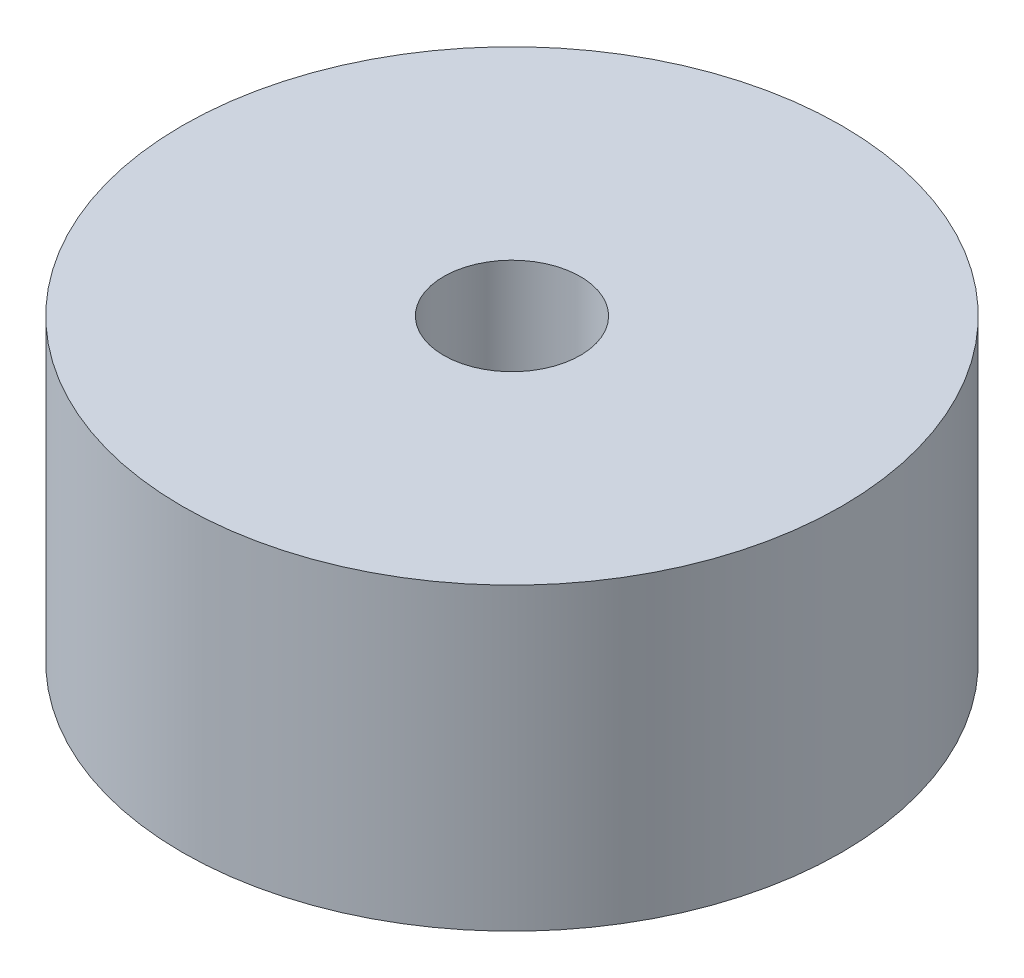
from build123d import *

# Parameters (mm, degrees)
SKETCH1_R           = 5.5
SKETCH1_R_2         = 1.14
BOSS_EXTRUDE1_DEPTH = 5


with BuildPart() as part:
    # Sketch1 → Boss-Extrude1 (new body)
    with BuildSketch(Plane(origin=(0, 0, 0), x_dir=(1, 0, 0), z_dir=(0, 1, 0))):
        with Locations(Location((0, 0, 0), (0, 0, 270))):
            Circle(SKETCH1_R)
        with Locations(Location((0, 0, 0), (0, 0, 270))):
            Circle(SKETCH1_R_2, mode=Mode.SUBTRACT)
    extrude(amount=BOSS_EXTRUDE1_DEPTH)


solid = part.part
